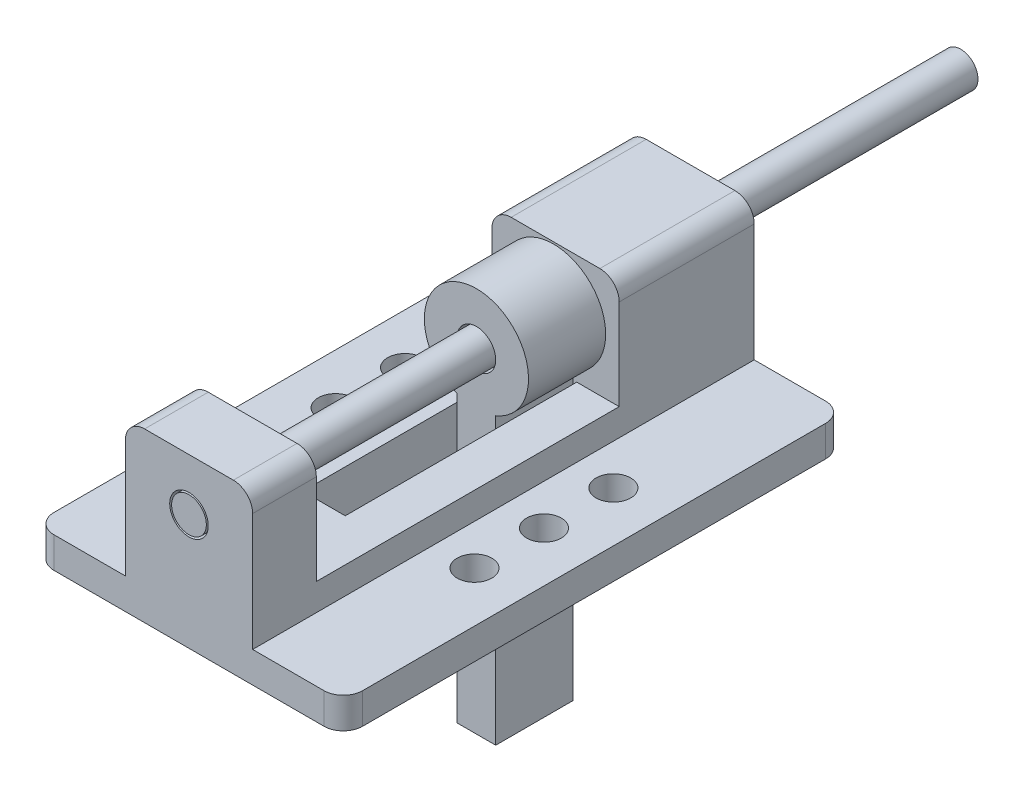
from build123d import *

# Parameters (mm, degrees)
IZIM1_W                     = 16
IZIM1_H                     = 26
IZIM1_R                     = 0.9
IZIM1_W_2                   = 2.2
IZIM1_H_2                   = 12
Y_KSEKLIK_EKSTR_ZYON1_DEPTH = 1.6
IZIM2_W                     = 6.6
IZIM2_H                     = 26
IZIM2_W_2                   = 2.2
IZIM2_H_2                   = 12
Y_KSEKLIK_EKSTR_ZYON2_DEPTH = 1.4
IZIM3_W                     = 6.6
IZIM3_H                     = 5.7
Y_KSEKLIK_EKSTR_ZYON3_DEPTH = 7
Y_KSEKLIK_EKSTR_ZYON4_DEPTH = 3.3
IZIM5_R                     = 1
KES_EKSTR_ZYON1_DEPTH       = 29.114231272
RADYUS1_R                   = 1
Y_KSEKLIK_EKSTR_ZYON5_START = 0.1
IZIM6_R                     = 2.7
IZIM6_R_2                   = 1
Y_KSEKLIK_EKSTR_ZYON5_DEPTH = 4
Y_KSEKLIK_EKSTR_ZYON6_START = -4
Y_KSEKLIK_EKSTR_ZYON6_DEPTH = 4
IZIM8_R                     = 0.9
Y_KSEKLIK_EKSTR_ZYON7_DEPTH = 40
RADYUS2_R                   = 1


with BuildPart() as part:
    # Çizim1 → Yükseklik-Ekstrüzyon1 (new body)
    with BuildSketch(Plane(origin=(0, 0, 0), x_dir=(1, 0, 0), z_dir=(0, 1, 0))):
        Rectangle(IZIM1_W, IZIM1_H)
        with Locations(Location((5.4, 0, 0), (0, 0, 270))):
            Circle(IZIM1_R, mode=Mode.SUBTRACT)
        with Locations(Location((5.4, 3.6, 0), (0, 0, 270))):
            Circle(IZIM1_R, mode=Mode.SUBTRACT)
        with Locations(Location((5.4, -3.6, 0), (0, 0, 90))):
            Circle(IZIM1_R, mode=Mode.SUBTRACT)
        with Locations(Location((-5.4, 3.6, 0), (0, 0, 90))):
            Circle(IZIM1_R, mode=Mode.SUBTRACT)
        with Locations(Location((-5.4, -3.6, 0), (0, 0, 270))):
            Circle(IZIM1_R, mode=Mode.SUBTRACT)
        with Locations(Location((-5.4, 0, 0), (0, 0, 90))):
            Circle(IZIM1_R, mode=Mode.SUBTRACT)
        Rectangle(IZIM1_W_2, IZIM1_H_2, mode=Mode.SUBTRACT)
    extrude(amount=-Y_KSEKLIK_EKSTR_ZYON1_DEPTH)

    # Çizim2 → Yükseklik-Ekstrüzyon2 (add)
    with BuildSketch(Plane(origin=(0, 0, 0), x_dir=(1, 0, 0), z_dir=(0, 1, 0))):
        Rectangle(IZIM2_W, IZIM2_H)
        Rectangle(IZIM2_W_2, IZIM2_H_2, mode=Mode.SUBTRACT)
    extrude(amount=Y_KSEKLIK_EKSTR_ZYON2_DEPTH)

    # Çizim3 → Yükseklik-Ekstrüzyon3 (add)
    with BuildSketch(Plane(origin=(0, 0, -13), x_dir=(-1, 0, 0), z_dir=(0, 0, -1))):
        with Locations((0, 4.25)):
            Rectangle(IZIM3_W, IZIM3_H)
    extrude(amount=-Y_KSEKLIK_EKSTR_ZYON3_DEPTH)

    # Çizim4 → Yükseklik-Ekstrüzyon4 (add)
    with BuildSketch(Plane.XY.offset(13)):
        Polygon((1.1, -1.6), (1.1, 1.4), (3.3, 1.4), (3.3, 7.1), (-3.3, 7.1), (-3.3, 1.4), (-1.1, 1.4), (-1.1, -1.6), align=None)
    extrude(amount=-Y_KSEKLIK_EKSTR_ZYON4_DEPTH)

    # Çizim5 → Kes-Ekstrüzyon1 (cut, through all)
    with BuildSketch(Plane(origin=(0, 0, -13), x_dir=(-1, 0, 0), z_dir=(0, 0, -1))):
        with Locations((0, 4.4)):
            Circle(IZIM5_R)
    extrude(amount=-KES_EKSTR_ZYON1_DEPTH, mode=Mode.SUBTRACT)

    # Radyus1
    radyus1_edges = [part.edges().sort_by_distance(p)[0] for p in [
        (-3.3, 7.1, 11.35),
        (3.3, 7.1, 11.35),
        (3.3, 7.1, -9.5),
        (-3.3, 7.1, -9.5),
    ]]
    fillet(radyus1_edges, radius=RADYUS1_R)

    # Radyus2
    radyus2_edges = [part.edges().sort_by_distance(p)[0] for p in [
        (8, -0.8, 13),
        (-8, -0.8, 13),
        (-8, -0.8, -13),
        (8, -0.8, -13),
    ]]
    fillet(radyus2_edges, radius=RADYUS2_R)


with BuildPart() as body_2:
    # Çizim6 → Yükseklik-Ekstrüzyon5 (new body)
    with BuildSketch(Plane.XY.offset(-6).offset(Y_KSEKLIK_EKSTR_ZYON5_START)):
        with Locations((0, 4.4)):
            Circle(IZIM6_R)
        with Locations((0, 4.4)):
            Circle(IZIM6_R_2, mode=Mode.SUBTRACT)
    extrude(amount=Y_KSEKLIK_EKSTR_ZYON5_DEPTH)

    # Çizim7 → Yükseklik-Ekstrüzyon6 (add)
    with BuildSketch(Plane.XY.offset(-1.9).offset(Y_KSEKLIK_EKSTR_ZYON6_START)):
        with BuildLine():
            ThreePointArc((1, 4.4), (0, 3.4), (-1, 4.4))
            Line((-1, 4.4), (-1, 1.892012759))
            ThreePointArc((-1, 1.892012759), (0, 1.7), (1, 1.892012759))
            Line((1, 1.892012759), (1, 4.4))
        make_face()
        with BuildLine():
            Line((-1, 1.892012759), (-1, 4.4))
            ThreePointArc((-1, 4.4), (0, 5.4), (1, 4.4))
            Line((1, 4.4), (1, 1.892012759))
            ThreePointArc((1, 1.892012759), (2.234949664, 2.885074259), (2.7, 4.4))
            ThreePointArc((2.7, 4.4), (-1.514925741, 6.634949664), (-1, 1.892012759))
        make_face()
        with BuildLine():
            ThreePointArc((1, 1.892012759), (0, 1.7), (-1, 1.892012759))
            Line((-1, 1.892012759), (-1, -12.9))
            Line((-1, -12.9), (1, -12.9))
            Line((1, -12.9), (1, 1.892012759))
        make_face()
    extrude(amount=Y_KSEKLIK_EKSTR_ZYON6_DEPTH)


with BuildPart() as body_3:
    # Çizim8 → Yükseklik-Ekstrüzyon7 (new body)
    with BuildSketch(Plane.XY.offset(13)):
        with Locations((0, 4.4)):
            Circle(IZIM8_R)
    extrude(amount=-Y_KSEKLIK_EKSTR_ZYON7_DEPTH)


solid = Compound([part.part, body_2.part, body_3.part])
